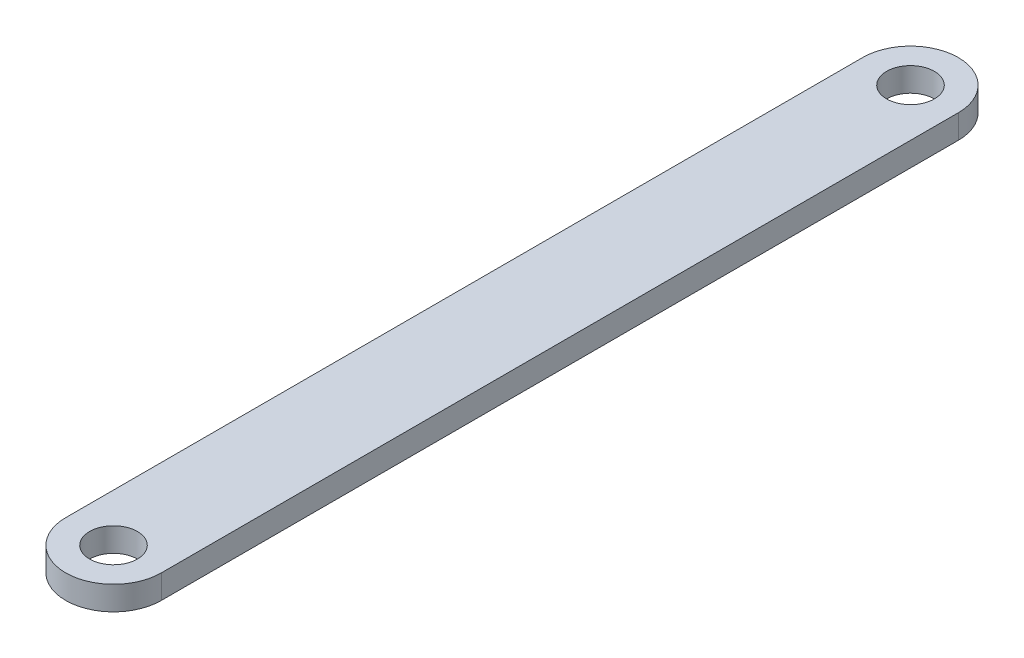
from build123d import *

# Parameters (mm, degrees)
SKETCH1_R           = 1.5
BOSS_EXTRUDE1_DEPTH = 1.5


with BuildPart() as part:
    # Sketch1 → Boss-Extrude1 (new body)
    with BuildSketch(Plane(origin=(0, 0, 0), x_dir=(1, 0, 0), z_dir=(0, 1, 0))):
        with BuildLine():
            Line((0, 0), (0, -50))
            ThreePointArc((0, -50), (3, -53), (6, -50))
            Line((6, -50), (6, 0))
            ThreePointArc((6, 0), (3, 3), (0, 0))
        make_face()
        with Locations(Location((3, 0, 0), (0, 0, 270))):
            Circle(SKETCH1_R, mode=Mode.SUBTRACT)
        with Locations(Location((3, -50, 0), (0, 0, 270))):
            Circle(SKETCH1_R, mode=Mode.SUBTRACT)
    extrude(amount=BOSS_EXTRUDE1_DEPTH)


solid = part.part
